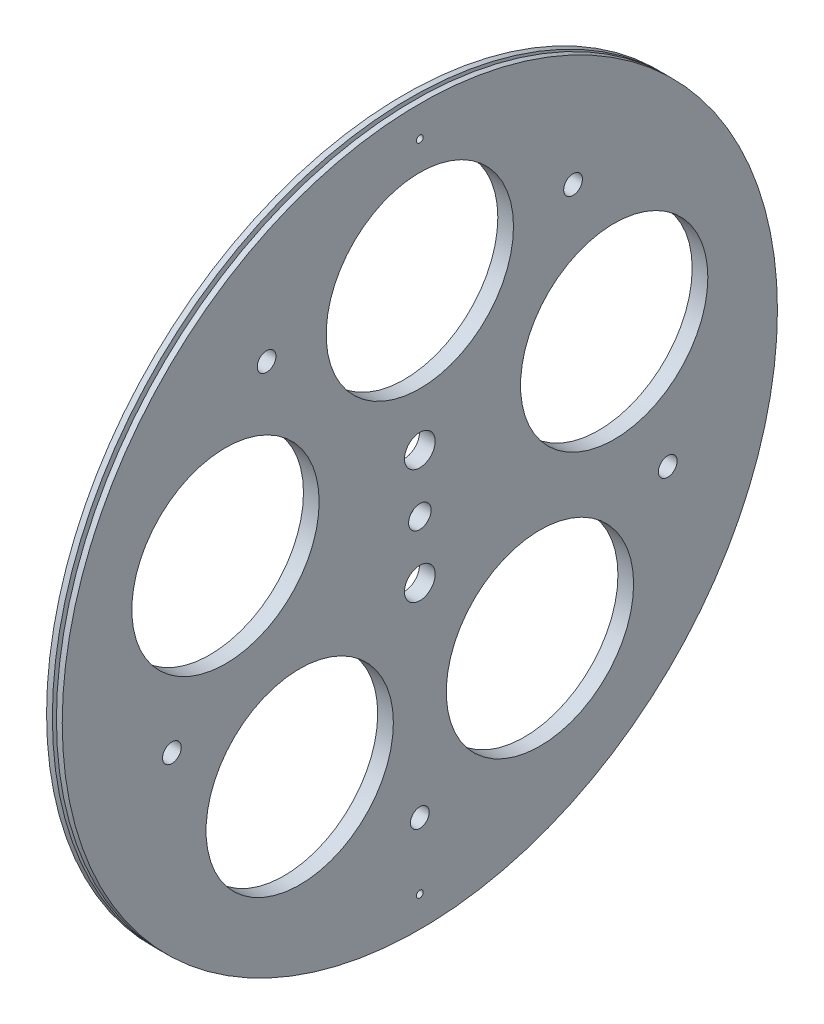
from build123d import *

# Parameters (mm, degrees)
SKETCH_22_R         = 3.3
SKETCH_22_R_2       = 4.5
SKETCH_22_R_3       = 1
SKETCH_22_R_4       = 27.5
SKETCH_22_R_5       = 2.75
CUT_EXTRUDE_1_DEPTH = 10


with BuildPart() as part:
    # 草图1 → 旋转1 (revolve)
    with BuildSketch(Plane.XY, mode=Mode.PRIVATE) as revolve_1_sk:
        Polygon((-21.9, 11), (-21.9, 25), (-21.9, 105), (-23, 105), (-23.6, 105), (-23.6, 95), (-24.2, 95), (-24.8, 95), (-24.8, 105), (-25, 105), (-26.5, 105), (-26.5, 98.307417596), (-26.5, 11), (-26.5, 0), (-21.9, 0), align=None)
    revolve(revolve_1_sk.sketch.rotate(Axis((-21, 0, 0), (1, 0, 0)), 90), axis=Axis((-21, 0, 0), (1, 0, 0)))

    # 草图22 → 切除-拉伸1 (cut)
    with BuildSketch(Plane(origin=(-21.9, 0, 0), x_dir=(0, 0, -1), z_dir=(1, 0, 0))):
        Circle(SKETCH_22_R)
        with Locations((0, 16.9)):
            Circle(SKETCH_22_R_2)
        with Locations((0, 96)):
            Circle(SKETCH_22_R_3)
        with Locations((0, 60)):
            Circle(SKETCH_22_R_4)
        with Locations((0, -16.9)):
            Circle(SKETCH_22_R_2)
        with Locations((57.063390978, 18.541019662)):
            Circle(SKETCH_22_R_4)
        with Locations((72.794835514, -23.652475842)):
            Circle(SKETCH_22_R_5)
        with Locations((35.267115138, -48.541019662)):
            Circle(SKETCH_22_R_4)
        with Locations((-35.267115138, -48.541019662)):
            Circle(SKETCH_22_R_4)
        with Locations((-57.063390978, 18.541019662)):
            Circle(SKETCH_22_R_4)
        with Locations((0, -96)):
            Circle(SKETCH_22_R_3)
        with Locations((0, -76.541019662)):
            Circle(SKETCH_22_R_5)
        with Locations((-72.794835514, -23.652475842)):
            Circle(SKETCH_22_R_5)
        with Locations((-44.989682553, 61.922985674)):
            Circle(SKETCH_22_R_5)
        with Locations((44.989682553, 61.922985674)):
            Circle(SKETCH_22_R_5)
    extrude(amount=-CUT_EXTRUDE_1_DEPTH, mode=Mode.SUBTRACT)


solid = part.part
